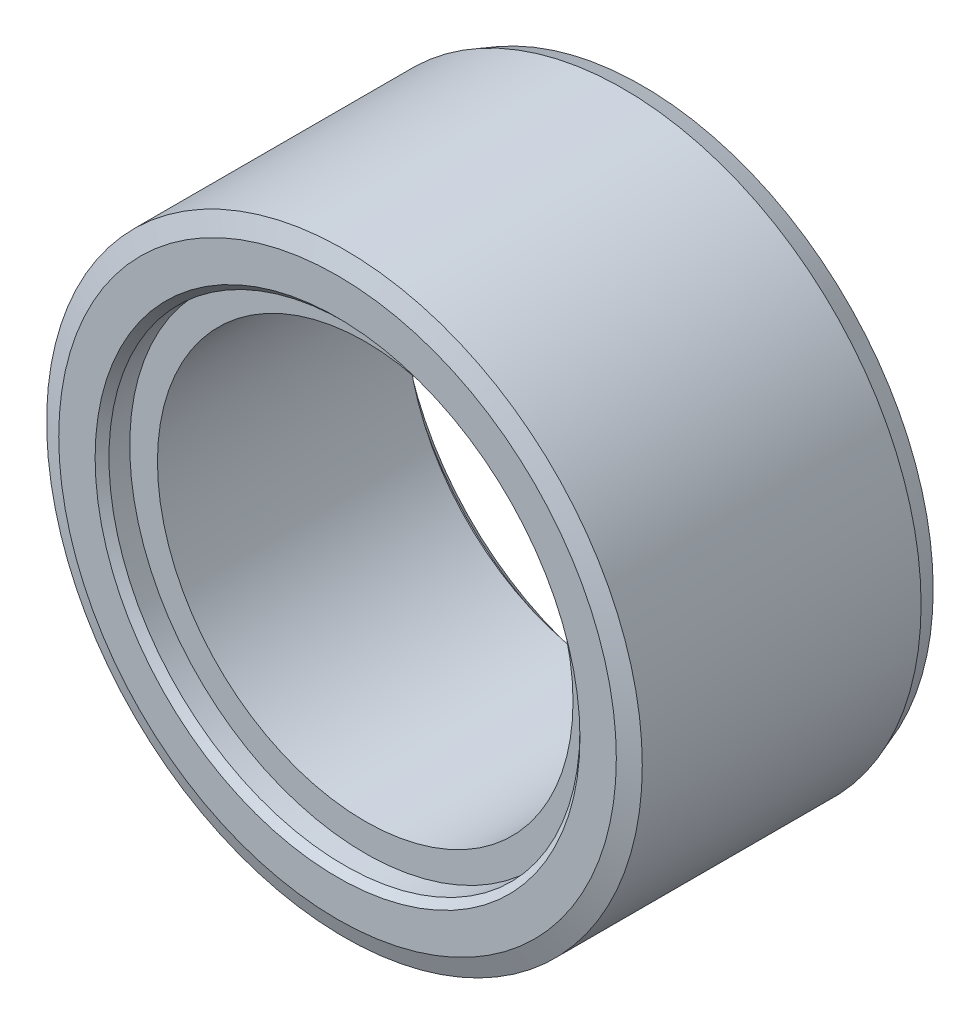
from build123d import *

# Parameters (mm, degrees)
SKETCH1_R           = 21.5
BOSS_EXTRUDE1_DEPTH = 22
SKETCH3_R           = 15
CUT_EXTRUDE1_DEPTH  = 22
SKETCH4_R           = 17
CUT_EXTRUDE2_DEPTH  = 2
CUT_EXTRUDE3_START  = -2
SKETCH5_R           = 17
CUT_EXTRUDE3_DEPTH  = 2
CHAMFER1_SIZE       = 0.5
CHAMFER3_SIZE       = 0.5
CHAMFER3_SIZE2      = 1.37373871
CHAMFER5_SIZE       = 0.5
CHAMFER5_SIZE2      = 1.37373871


with BuildPart() as part:
    # Sketch1 → Boss-Extrude1 (new body)
    with BuildSketch(Plane.XY):
        Circle(SKETCH1_R)
    extrude(amount=BOSS_EXTRUDE1_DEPTH)

    # Sketch3 → Cut-Extrude1 (cut)
    with BuildSketch(Plane.XY.offset(22)):
        Circle(SKETCH3_R)
    extrude(amount=-CUT_EXTRUDE1_DEPTH, mode=Mode.SUBTRACT)

    # Sketch4 → Cut-Extrude2 (cut)
    with BuildSketch(Plane.XY.offset(22)):
        Circle(SKETCH4_R)
    extrude(amount=-CUT_EXTRUDE2_DEPTH, mode=Mode.SUBTRACT)

    # Sketch5 → Cut-Extrude3 (cut)
    with BuildSketch(Plane(origin=(0, 0, 0), x_dir=(-1, 0, 0), z_dir=(0, 0, -1)).offset(CUT_EXTRUDE3_START)):
        with Locations(Location((0, 0, 0), (0, 0, 180))):
            Circle(SKETCH5_R)
    extrude(amount=CUT_EXTRUDE3_DEPTH, mode=Mode.SUBTRACT)

    # Chamfer1
    chamfer1_edges = [part.edges().sort_by_distance(p)[0] for p in [
        (-17, 0, 22),
        (-17, 0, 0),
    ]]
    chamfer(chamfer1_edges, length=CHAMFER1_SIZE)

    # Chamfer3
    chamfer3_edges = [part.edges().sort_by_distance(p)[0] for p in [
        (-21.5, 0, 0),
    ]]
    chamfer3_side = [part.faces().sort_by_distance(p)[0] for p in [
        (-18.108111832, 0, 0),
    ]]
    chamfer(chamfer3_edges, length=CHAMFER3_SIZE, length2=CHAMFER3_SIZE2, reference=chamfer3_side[0])

    # Chamfer5
    chamfer5_edges = [part.edges().sort_by_distance(p)[0] for p in [
        (-21.5, 0, 22),
    ]]
    chamfer5_side = [part.faces().sort_by_distance(p)[0] for p in [
        (-21.5, 0, 11.686869355),
    ]]
    chamfer(chamfer5_edges, length=CHAMFER5_SIZE, length2=CHAMFER5_SIZE2, reference=chamfer5_side[0])


solid = part.part
